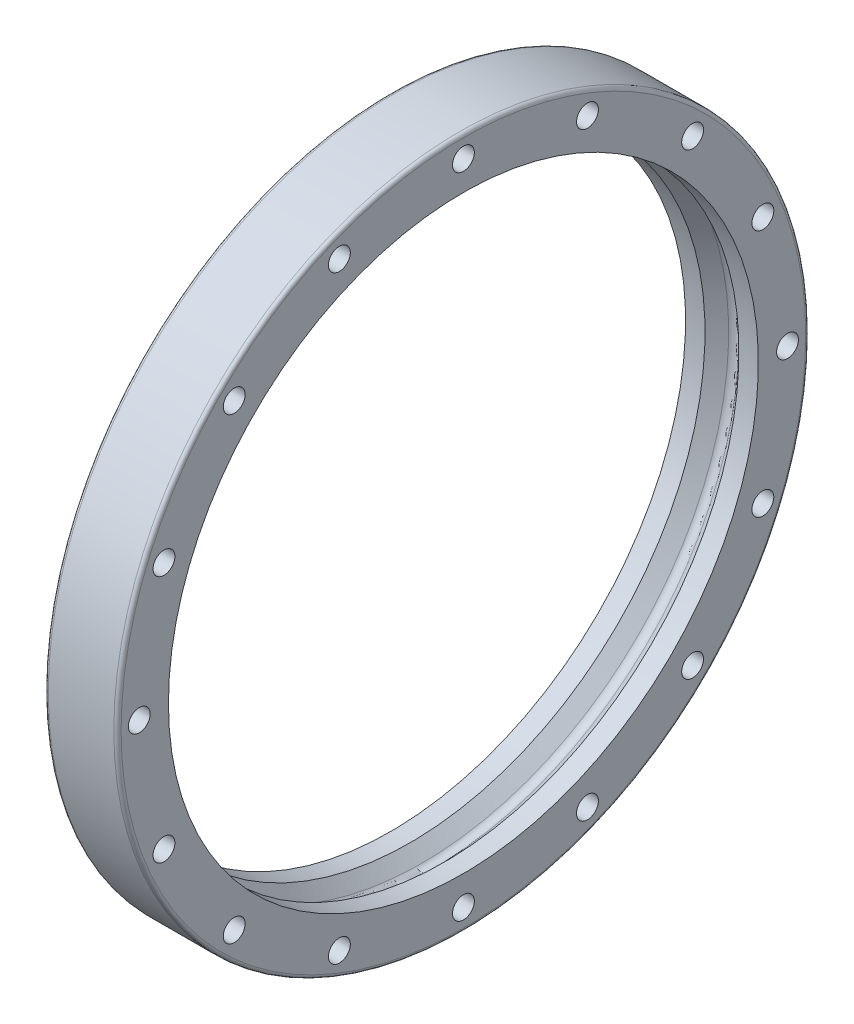
from build123d import *

# Parameters (mm, degrees)
FILLET1_R          = 2
SKETCH2_R          = 3
CUT_EXTRUDE1_DEPTH = 136.830777072
CIRPATTERN1_COUNT  = 16
FILLET2_R          = 1


with BuildPart() as part:
    # Sketch1 → Revolve1 (revolve)
    with BuildSketch(Plane.XY, mode=Mode.PRIVATE) as revolve1_sk:
        Polygon((-4.656854249, 81), (0, 85.656854249), (4.656854249, 81), (10, 81), (10, 95), (-10, 95), (-10, 81), align=None)
    revolve(revolve1_sk.sketch.rotate(Axis((-42.067307692, 0, 0), (1, 0, 0)), 90), axis=Axis((-42.067307692, 0, 0), (1, 0, 0)))

    # Fillet1
    fillet1_edges = [part.edges().sort_by_distance(p)[0] for p in [
        (0, 0, -85.656854249),
    ]]
    fillet(fillet1_edges, radius=FILLET1_R)

    # Sketch2 → Cut-Extrude1 (cut, through all)
    with BuildSketch(Plane(origin=(10, 0, 0), x_dir=(0, 0, -1), z_dir=(1, 0, 0))):
        with Locations((0, 89)):
            Circle(SKETCH2_R)
    cut_extrude1 = extrude(amount=-CUT_EXTRUDE1_DEPTH, mode=Mode.SUBTRACT)

    # CirPattern1: Cut-Extrude1 ×16 about axis
    cirpattern1_axis = Axis((0, 0, 0), (1, 0, 0))
    for i in range(1, CIRPATTERN1_COUNT):
        add(cut_extrude1.rotate(cirpattern1_axis, i * 360 / CIRPATTERN1_COUNT), mode=Mode.SUBTRACT)

    # Fillet2
    fillet2_edges = [part.edges().sort_by_distance(p)[0] for p in [
        (-10, 0, -95),
        (10, 0, -95),
    ]]
    fillet(fillet2_edges, radius=FILLET2_R)


solid = part.part
